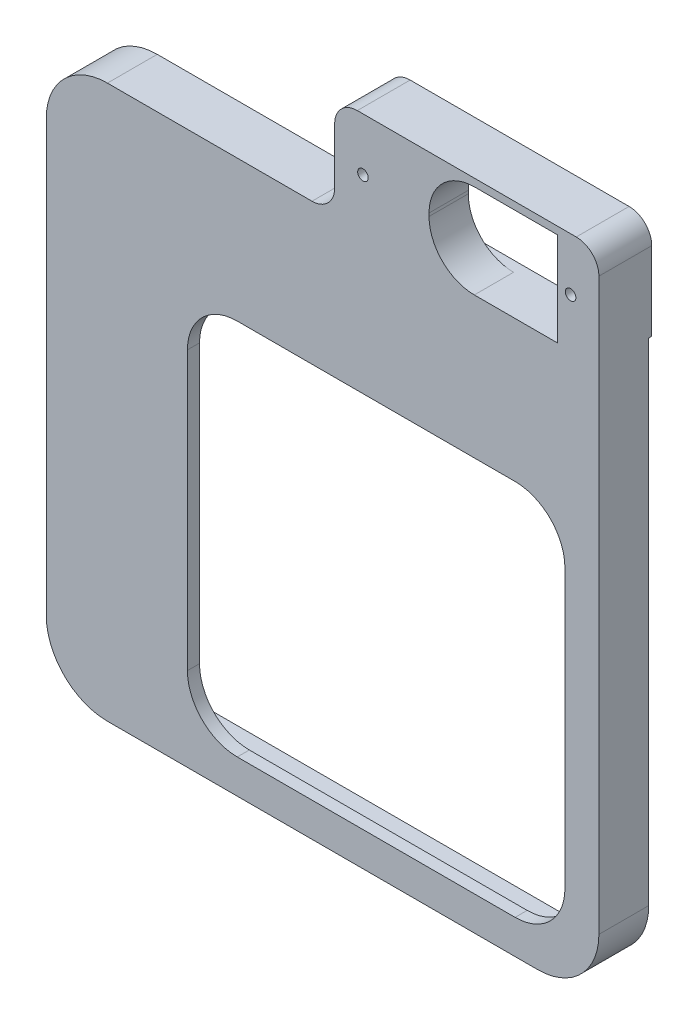
from build123d import *

# Parameters (mm, degrees)
SKETCH1_W           = 73.2
SKETCH1_H           = 73.2
SKETCH1_W_2         = 70.2
SKETCH1_H_2         = 70.2
BOSS_EXTRUDE1_DEPTH = 5
SKETCH2_W           = 73.2
SKETCH2_H           = 73.2
BOSS_EXTRUDE2_DEPTH = 1.6
FILLET1_R           = 6.6
SKETCH3_W           = 50
SKETCH3_H           = 50
CUT_EXTRUDE1_DEPTH  = 1.6
FILLET2_R           = 6.6
SKETCH5_W           = 35
SKETCH5_H           = 12.4
BOSS_EXTRUDE3_DEPTH = 7
SKETCH6_W           = 24
SKETCH6_H           = 12.4
CUT_EXTRUDE2_DEPTH  = 1.8
SKETCH7_W           = 17
SKETCH7_H           = 12.4
CUT_EXTRUDE3_DEPTH  = 10.8
SKETCH8_W           = 35
SKETCH8_H           = 7
BOSS_EXTRUDE4_DEPTH = 1
FILLET3_R           = 8.1
FILLET4_R           = 3
FILLET5_R           = 6
SKETCH9_R           = 0.7
CUT_EXTRUDE4_DEPTH  = 10


with BuildPart() as part:
    # Sketch1 → Boss-Extrude1 (new body)
    with BuildSketch(Plane.XY):
        with Locations((35.1, 35.1)):
            Rectangle(SKETCH1_W, SKETCH1_H)
        with Locations((35.1, 35.1)):
            Rectangle(SKETCH1_W_2, SKETCH1_H_2, mode=Mode.SUBTRACT)
    extrude(amount=BOSS_EXTRUDE1_DEPTH)

    # Sketch2 → Boss-Extrude2 (add)
    with BuildSketch(Plane.XY.offset(5)):
        with Locations((35.1, 35.1)):
            Rectangle(SKETCH2_W, SKETCH2_H)
    extrude(amount=BOSS_EXTRUDE2_DEPTH)

    # Fillet1
    fillet1_edges = [part.edges().sort_by_distance(p)[0] for p in [
        (0, 70.2, 2.5),
        (0, 0, 2.5),
        (70.2, 0, 2.5),
        (70.2, 70.2, 2.5),
    ]]
    fillet(fillet1_edges, radius=FILLET1_R)

    # Sketch3 → Cut-Extrude1 (cut)
    with BuildSketch(Plane(origin=(0, 0, 5), x_dir=(-1, 0, 0), z_dir=(0, 0, -1))):
        with Locations((-42.2, 28)):
            Rectangle(SKETCH3_W, SKETCH3_H)
    extrude(amount=-CUT_EXTRUDE1_DEPTH, mode=Mode.SUBTRACT)

    # Fillet2
    fillet2_edges = [part.edges().sort_by_distance(p)[0] for p in [
        (67.2, 3, 5.8),
        (67.2, 53, 5.8),
        (17.2, 53, 5.8),
        (17.2, 3, 5.8),
    ]]
    fillet(fillet2_edges, radius=FILLET2_R)

    # Sketch5 → Boss-Extrude3 (add)
    with BuildSketch(Plane.XY.offset(6.6)):
        with Locations((54.2, 77.9)):
            Rectangle(SKETCH5_W, SKETCH5_H)
    extrude(amount=-BOSS_EXTRUDE3_DEPTH)

    # Sketch6 → Cut-Extrude2 (cut)
    with BuildSketch(Plane(origin=(0, 0, -0.4), x_dir=(-1, 0, 0), z_dir=(0, 0, -1))):
        with Locations((-54.2, 77.9)):
            Rectangle(SKETCH6_W, SKETCH6_H)
    extrude(amount=-CUT_EXTRUDE2_DEPTH, mode=Mode.SUBTRACT)

    # Sketch7 → Cut-Extrude3 (cut)
    with BuildSketch(Plane(origin=(0, 0, 1.4), x_dir=(-1, 0, 0), z_dir=(0, 0, -1))):
        with Locations((-57.7, 77.9)):
            Rectangle(SKETCH7_W, SKETCH7_H)
    extrude(amount=-CUT_EXTRUDE3_DEPTH, mode=Mode.SUBTRACT)

    # Sketch8 → Boss-Extrude4 (add)
    with BuildSketch(Plane(origin=(0, 84.1, 0), x_dir=(1, 0, 0), z_dir=(0, 1, 0))):
        with Locations((54.2, -3.1)):
            Rectangle(SKETCH8_W, SKETCH8_H)
    extrude(amount=BOSS_EXTRUDE4_DEPTH)

    # Fillet3
    fillet3_edges = [part.edges().sort_by_distance(p)[0] for p in [
        (71.7, -1.5, 3.3),
        (-1.5, -1.5, 3.3),
        (-1.5, 71.7, 3.3),
    ]]
    fillet(fillet3_edges, radius=FILLET3_R)

    # Fillet4
    fillet4_edges = [part.edges().sort_by_distance(p)[0] for p in [
        (71.7, 85.1, 3.1),
        (36.7, 85.1, 3.1),
        (36.7, 71.7, 3.3),
    ]]
    fillet(fillet4_edges, radius=FILLET4_R)

    # Fillet5
    fillet5_edges = [part.edges().sort_by_distance(p)[0] for p in [
        (49.2, 84.1, 4),
        (49.2, 71.7, 4),
    ]]
    fillet(fillet5_edges, radius=FILLET5_R)

    # Sketch9 → Cut-Extrude4 (cut)
    with BuildSketch(Plane(origin=(0, 0, -0.4), x_dir=(-1, 0, 0), z_dir=(0, 0, -1))):
        with Locations((-40.448812376, 78.1)):
            Circle(SKETCH9_R)
        with Locations((-67.948812376, 78.1)):
            Circle(SKETCH9_R)
    extrude(amount=-CUT_EXTRUDE4_DEPTH, mode=Mode.SUBTRACT)


solid = part.part
